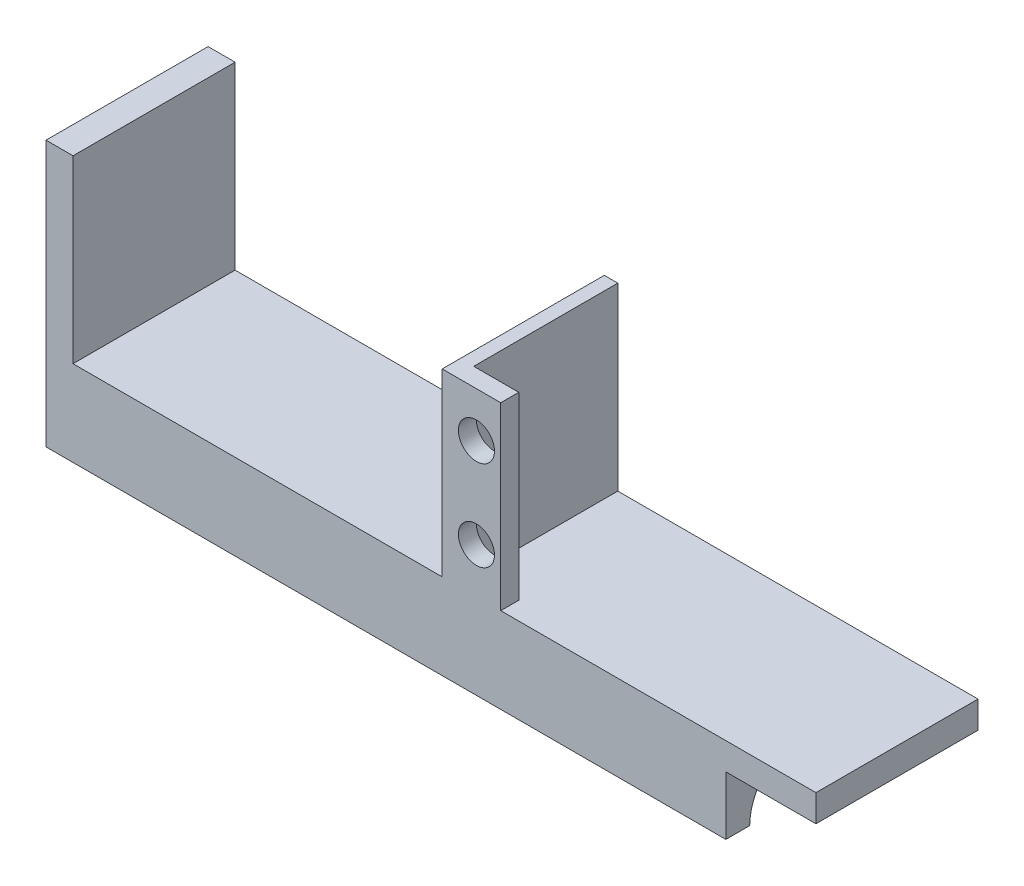
from build123d import *

# Parameters (mm, degrees)
SKETCH1_W            = 45.5
SKETCH1_H            = 18
BOSS_EXTRUDE1_DEPTH  = 3
SKETCH2_W            = 3
SKETCH2_H            = 18
SKETCH2_W_2          = 1.5
BOSS_EXTRUDE2_DEPTH  = 20
SKETCH6_W            = 2
SKETCH6_H            = 20
BOSS_EXTRUDE5_DEPTH  = 5
SKETCH7_R            = 2
CUT_EXTRUDE2_DEPTH   = 2
BOSS_EXTRUDE9_DEPTH  = 75.5
SKETCH9_W            = 18
SKETCH9_H            = 3
BOSS_EXTRUDE10_DEPTH = 40


with BuildPart() as part:
    # Sketch1 → Boss-Extrude1 (new body)
    with BuildSketch(Plane(origin=(0, 0, 0), x_dir=(1, 0, 0), z_dir=(0, 1, 0))):
        Rectangle(SKETCH1_W, SKETCH1_H)
    extrude(amount=BOSS_EXTRUDE1_DEPTH)

    # Sketch2 → Boss-Extrude2 (add)
    with BuildSketch(Plane(origin=(0, 3, 0), x_dir=(1, 0, 0), z_dir=(0, 1, 0))):
        with Locations((-21.25, 0)):
            Rectangle(SKETCH2_W, SKETCH2_H)
        with Locations((22, 0)):
            Rectangle(SKETCH2_W_2, SKETCH2_H)
    extrude(amount=BOSS_EXTRUDE2_DEPTH)

    # Sketch6 → Boss-Extrude5 (add)
    with BuildSketch(Plane(origin=(22.75, 0, 0), x_dir=(0, 0, -1), z_dir=(1, 0, 0))):
        with Locations((-8, 13)):
            Rectangle(SKETCH6_W, SKETCH6_H)
    extrude(amount=BOSS_EXTRUDE5_DEPTH)

    # Sketch7 → Cut-Extrude2 (cut)
    with BuildSketch(Plane.XY.offset(9)):
        with Locations((25.05, 8)):
            Circle(SKETCH7_R)
        with Locations((25.05, 18)):
            Circle(SKETCH7_R)
    extrude(amount=-CUT_EXTRUDE2_DEPTH, mode=Mode.SUBTRACT)

    # 3DSketch1 → Boss-Extrude9 (add)
    with BuildSketch(Plane(origin=(-22.75, 0, 9), x_dir=(0, -0.3396444637775567, -0.9405538996916956), z_dir=(-1, 0, 0))):
        with BuildLine():
            Line((0, 0), (2.207689015, 6.113600348))
            Line((2.207689015, 6.113600348), (4.696214266, 5.214966229))
            ThreePointArc((4.696214266, 5.214966229), (8.301670881, -2.466223951), (15.982861062, 1.139232664))
            Line((15.982861062, 1.139232664), (19.137659209, 0))
            Line((19.137659209, 0), (16.929970194, -6.113600348))
            Line((16.929970194, -6.113600348), (0, 0))
        make_face()
    extrude(amount=-BOSS_EXTRUDE9_DEPTH)

    # Sketch9 → Boss-Extrude10 (add)
    with BuildSketch(Plane(origin=(22.75, 0, 0), x_dir=(0, 0, -1), z_dir=(1, 0, 0))):
        with Locations((0, 1.5)):
            Rectangle(SKETCH9_W, SKETCH9_H)
    extrude(amount=BOSS_EXTRUDE10_DEPTH)


solid = part.part
